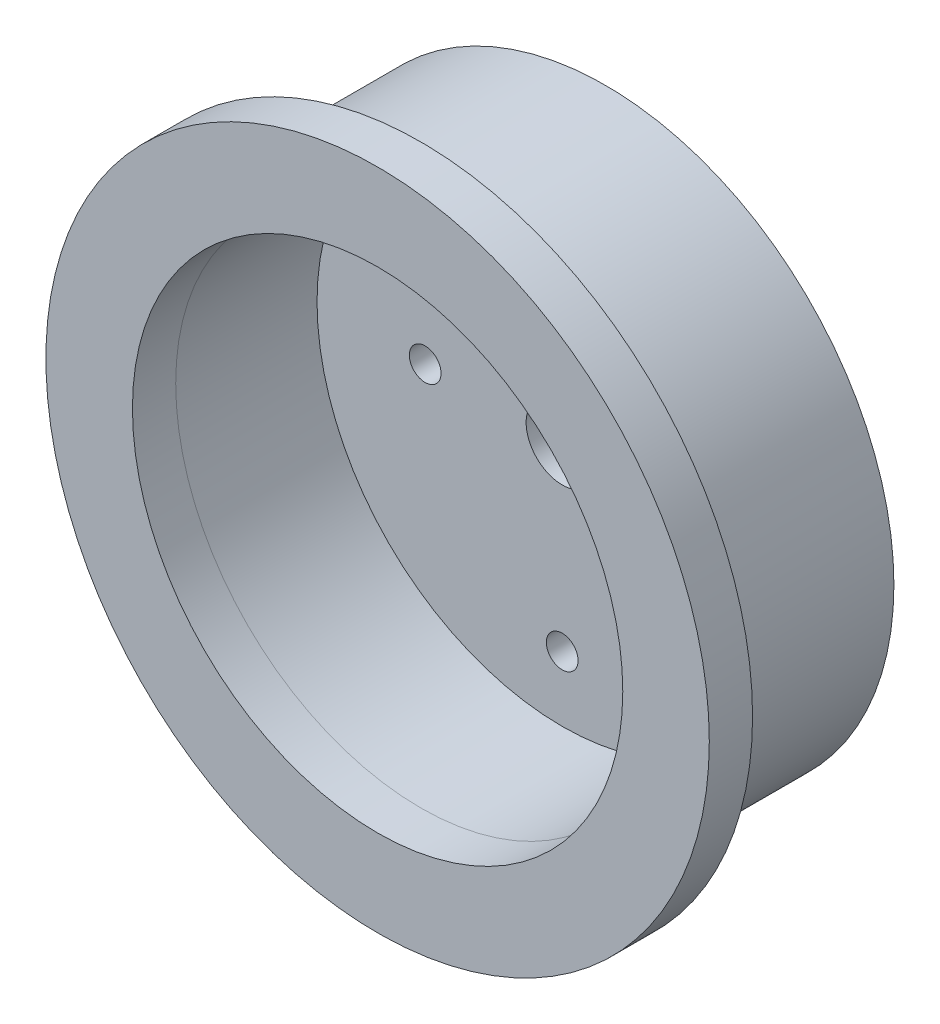
from build123d import *

# Parameters (mm, degrees)
SKETCH_1_R          = 20
EXTRUDE_1_DEPTH     = 12.8
SKETCH_2_R          = 17
CUT_EXTRUDE_1_DEPTH = 9.8
SKETCH_3_R          = 23
SKETCH_3_R_2        = 17
EXTRUDE_2_DEPTH     = 3
SKETCH_4_R          = 1.1
CUT_EXTRUDE_2_DEPTH = 35.954827993
SKETCH_6_R          = 2.5
CUT_EXTRUDE_4_DEPTH = 10


with BuildPart() as part:
    # 草图1 → 凸台-拉伸1 (new body)
    with BuildSketch(Plane.XY):
        Circle(SKETCH_1_R)
    extrude(amount=EXTRUDE_1_DEPTH)

    # 草图2 → 切除-拉伸1 (cut)
    with BuildSketch(Plane.XY.offset(12.8)):
        Circle(SKETCH_2_R)
    extrude(amount=-CUT_EXTRUDE_1_DEPTH, mode=Mode.SUBTRACT)

    # 草图4 → 切除-拉伸2 (cut, through all)
    with BuildSketch(Plane.XY.offset(3)):
        with Locations((0, -12.5)):
            Circle(SKETCH_4_R)
        with Locations((0, 12.5)):
            Circle(SKETCH_4_R)
        with Locations((9.5, 0)):
            Circle(SKETCH_4_R)
        with Locations((-9.5, 0)):
            Circle(SKETCH_4_R)
    extrude(amount=-CUT_EXTRUDE_2_DEPTH, mode=Mode.SUBTRACT)

    # 草图6 → 切除-拉伸4 (cut)
    with BuildSketch(Plane.XY.offset(3)):
        Circle(SKETCH_6_R)
    extrude(amount=-CUT_EXTRUDE_4_DEPTH, mode=Mode.SUBTRACT)


with BuildPart() as body_2:
    # 草图3 → 凸台-拉伸2 (new body)
    with BuildSketch(Plane.XY.offset(12.8)):
        Circle(SKETCH_3_R)
        Circle(SKETCH_3_R_2, mode=Mode.SUBTRACT)
    extrude(amount=EXTRUDE_2_DEPTH)


solid = Compound([part.part, body_2.part])
